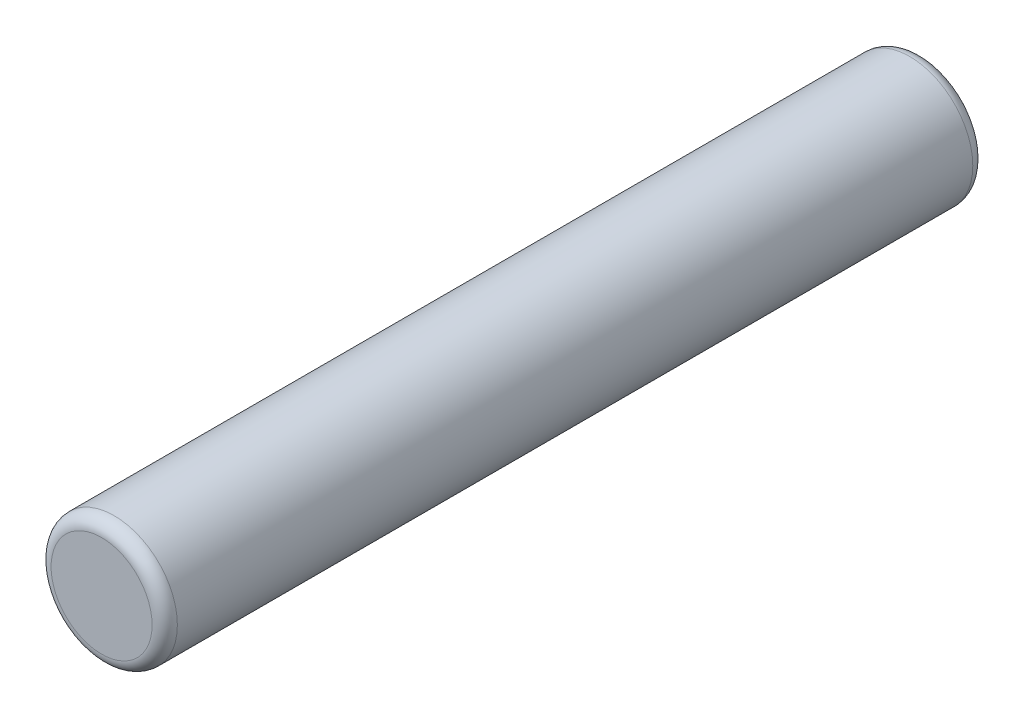
from build123d import *

# Parameters (mm, degrees)
ESQUISSE1_R        = 10
BOSS_EXTRU_1_DEPTH = 130
CONG_1_R           = 2


with BuildPart() as part:
    # Esquisse1 → Boss.-Extru.1 (new body)
    with BuildSketch(Plane.XY):
        Circle(ESQUISSE1_R)
    extrude(amount=BOSS_EXTRU_1_DEPTH)

    # Congé1
    cong_1_edges = [part.edges().sort_by_distance(p)[0] for p in [
        (-10, 0, 0),
        (-10, 0, 130),
    ]]
    fillet(cong_1_edges, radius=CONG_1_R)


solid = part.part
